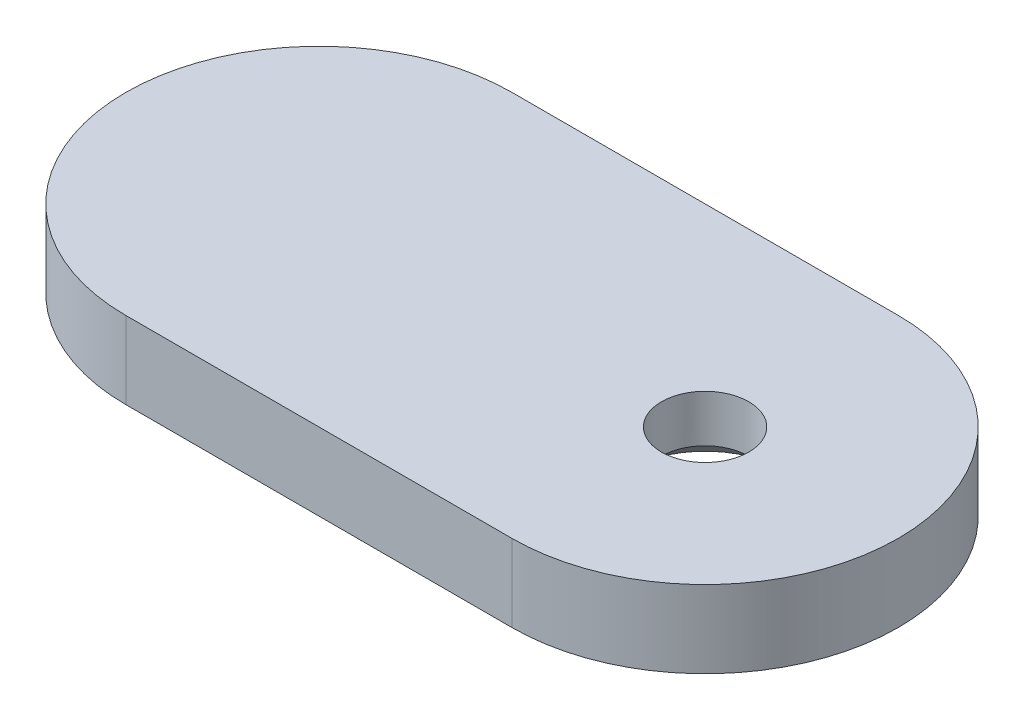
from build123d import *

# Parameters (mm, degrees)
BOSS_EXTRUDE1_DEPTH             = 2
F_4_40_TAPPED_HOLE1_D           = 2.2606
F_4_40_TAPPED_HOLE1_DEPTH       = 30
F_4_40_TAPPED_HOLE1_CSINK_D     = 4.1148
F_4_40_TAPPED_HOLE1_CSINK_ANGLE = 100
F_4_40_TAPPED_HOLE1_TIP         = 0.679152758


with BuildPart() as part:
    # Sketch1 → Boss-Extrude1 (new body)
    with BuildSketch(Plane(origin=(0, 0, 0), x_dir=(1, 0, 0), z_dir=(0, 1, 0))):
        with BuildLine():
            Line((-6.920754264, 5), (3.079245736, 5))
            ThreePointArc((3.079245736, 5), (8.079245736, 0), (3.079245736, -5))
            Line((3.079245736, -5), (-6.920754264, -5))
            ThreePointArc((-6.920754264, -5), (-11.920754264, 0), (-6.920754264, 5))
        make_face()
    extrude(amount=BOSS_EXTRUDE1_DEPTH)

    # #4-40 Tapped Hole1
    with Locations(Plane(origin=(28.793519494, 0, 54.352929604), x_dir=(-0.6824480483722141, 0, -0.7309341018675735), z_dir=(0, -1, 0))):
        with Locations((57.277065725, 18.297611137)):
            CounterSinkHole(F_4_40_TAPPED_HOLE1_D / 2, F_4_40_TAPPED_HOLE1_CSINK_D / 2, depth=F_4_40_TAPPED_HOLE1_DEPTH, counter_sink_angle=F_4_40_TAPPED_HOLE1_CSINK_ANGLE)
            with Locations((0, 0, -(F_4_40_TAPPED_HOLE1_DEPTH + F_4_40_TAPPED_HOLE1_TIP / 2))):  # 118° drill point
                Cone(0, F_4_40_TAPPED_HOLE1_D / 2, F_4_40_TAPPED_HOLE1_TIP, mode=Mode.SUBTRACT)


solid = part.part
